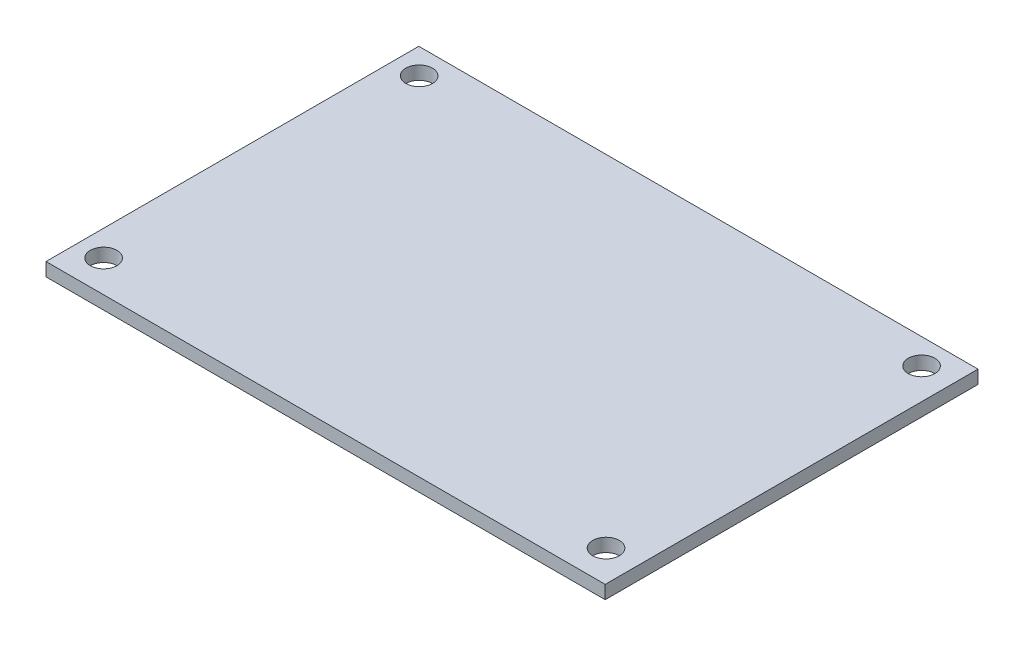
from build123d import *

# Parameters (mm, degrees)
SKETCH1_W           = 63
SKETCH1_H           = 42
BOSS_EXTRUDE1_DEPTH = 1.5
SKETCH2_R           = 1.5
CUT_EXTRUDE1_DEPTH  = 38.887992821


with BuildPart() as part:
    # Sketch1 → Boss-Extrude1 (new body)
    with BuildSketch(Plane(origin=(0, 0, 0), x_dir=(1, 0, 0), z_dir=(0, 1, 0))):
        Rectangle(SKETCH1_W, SKETCH1_H)
    extrude(amount=BOSS_EXTRUDE1_DEPTH)

    # Sketch2 → Cut-Extrude1 (cut, through all)
    with BuildSketch(Plane(origin=(0, 1.5, 0), x_dir=(1, 0, 0), z_dir=(0, 1, 0))):
        with Locations(Location((-28.597553498, 18.135833812, 0), (0, 0, 270))):
            Circle(SKETCH2_R)
        with Locations(Location((28.007237026, 18.135833812, 0), (0, 0, 270))):
            Circle(SKETCH2_R)
        with Locations(Location((28.007237026, -17.414335903, 0), (0, 0, 270))):
            Circle(SKETCH2_R)
        with Locations(Location((-28.597553498, -17.414335903, 0), (0, 0, 270))):
            Circle(SKETCH2_R)
    extrude(amount=-CUT_EXTRUDE1_DEPTH, mode=Mode.SUBTRACT)


solid = part.part
